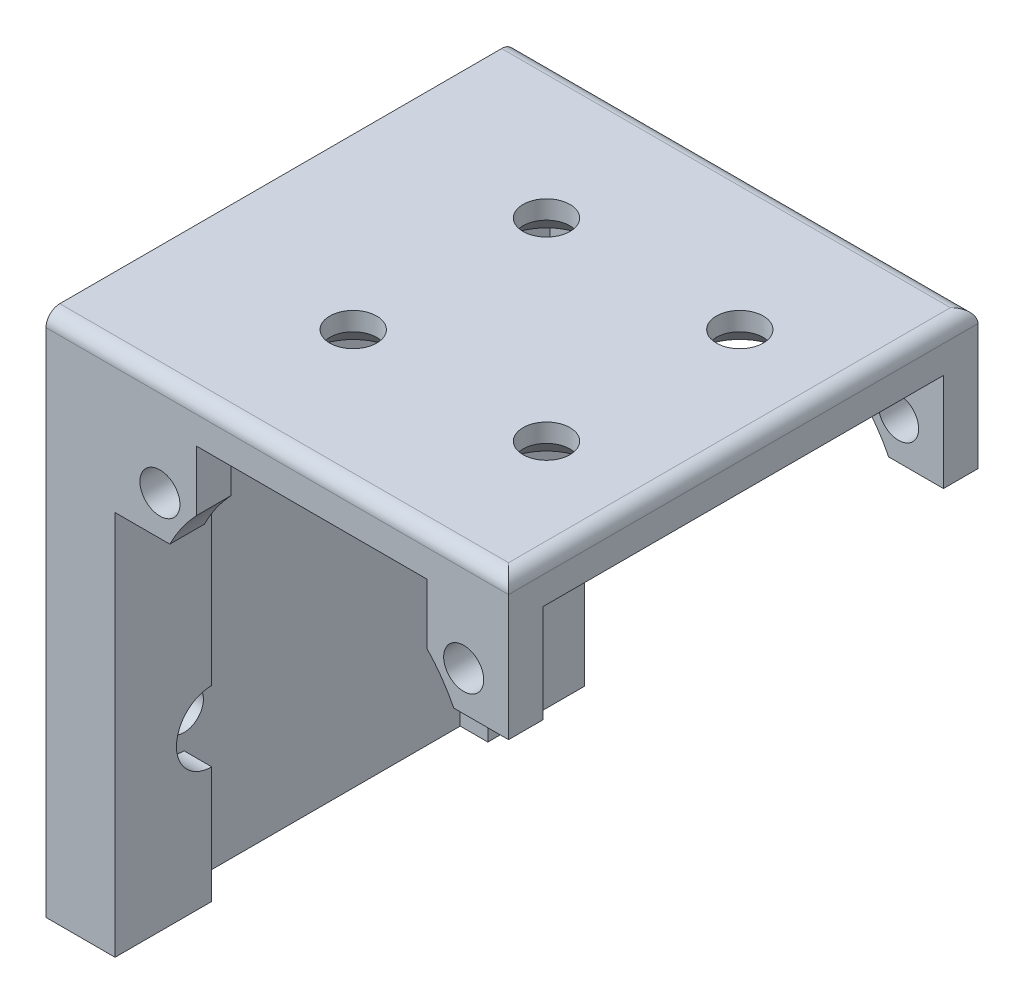
from build123d import *

# Parameters (mm, degrees)
BOSS_EXTRUDE7_DEPTH                            = 17
BOSS_EXTRUDE7_DEPTH_BACK                       = 17
SKETCH1_R                                      = 1.45
SKETCH34_W                                     = 28.4
SKETCH34_H                                     = 7.5
CUT_EXTRUDE11_DEPTH                            = 37.521397837
SKETCH35_R                                     = 5
CUT_EXTRUDE12_DEPTH                            = 25.542055741
CSK_FOR_M3_HEX_SOCKET_COUNTERSUNK_CA_2_COUNT   = 2
CSK_FOR_M3_HEX_SOCKET_COUNTERSUNK_CA_2_PITCH   = 16.5
CSK_FOR_M3_HEX_SOCKET_COUNTERSUNK_CA_3_COUNT   = 2
CSK_FOR_M3_HEX_SOCKET_COUNTERSUNK_CA_3_PITCH   = 18
CSK_FOR_M3_HEX_SOCKET_COUNTERSUNK_CA_4_COUNT   = 2
CSK_FOR_M3_HEX_SOCKET_COUNTERSUNK_CA_4_PITCH   = 24.418230894
FILLET5_R                                      = 1
SKETCH41_W                                     = 28.5
SKETCH41_H                                     = 0.4
CUT_EXTRUDE13_DEPTH                            = 40.895175147
BOSS_EXTRUDE8_START                            = 5
BOSS_EXTRUDE8_DEPTH                            = 5
SKETCH48_R                                     = 1.4
CUT_EXTRUDE14_DEPTH                            = 5
SKETCH49_R                                     = 2.55
CUT_EXTRUDE15_DEPTH                            = 2
SKETCH51_W                                     = 24.851878452
SKETCH51_H                                     = 29.94943361
BOSS_EXTRUDE9_DEPTH                            = 3
CSK_FOR_M3_HEX_SOCKET_COUNTERSUNK_CA_5_A_COUNT = 2
CSK_FOR_M3_HEX_SOCKET_COUNTERSUNK_CA_5_A_PITCH = 14
CSK_FOR_M3_HEX_SOCKET_COUNTERSUNK_CA_6_COUNT   = 2
CSK_FOR_M3_HEX_SOCKET_COUNTERSUNK_CA_6_PITCH   = 19.798989873
CSK_FOR_M3_HEX_SOCKET_COUNTERSUNK_CA_7_COUNT   = 2
CSK_FOR_M3_HEX_SOCKET_COUNTERSUNK_CA_7_PITCH   = 14
SKETCH54_W                                     = 20
SKETCH54_H                                     = 27
CUT_EXTRUDE20_DEPTH                            = 2
SKETCH55_W                                     = 29
SKETCH55_H                                     = 7.1
CUT_EXTRUDE21_DEPTH                            = 28.5
SKETCH56_W                                     = 16.7
SKETCH56_H                                     = 5.607195889
CUT_EXTRUDE22_DEPTH                            = 34


with BuildPart() as part:
    # Sketch1 → Boss-Extrude7 (new, two sides: drawn at the far end of the back side and taken through both)
    with BuildSketch(Plane.XY.offset(-BOSS_EXTRUDE7_DEPTH_BACK)):
        with BuildLine():
            Line((-14.25, 15.25), (-14.25, 4.75))
            Line((-14.25, 4.75), (-10.473180033, 4.75))
            ThreePointArc((-10.473180033, 4.75), (-9.502581542, 6.476954843), (-8.25, 8.011710179))
            Line((-8.25, 8.011710179), (-8.25, 12.25))
            Line((-8.25, 12.25), (8.25, 12.25))
            Line((8.25, 12.25), (8.25, 8.011710179))
            ThreePointArc((8.25, 8.011710179), (9.502581542, 6.476954843), (10.473180033, 4.75))
            Line((10.473180033, 4.75), (14.25, 4.75))
            Line((14.25, 4.75), (14.25, 15.25))
            Line((14.25, 15.25), (-14.25, 15.25))
        make_face()
        with Locations((11, 8)):
            Circle(SKETCH1_R, mode=Mode.SUBTRACT)
        with Locations((-11, 8)):
            Circle(SKETCH1_R, mode=Mode.SUBTRACT)
    extrude(amount=BOSS_EXTRUDE7_DEPTH + BOSS_EXTRUDE7_DEPTH_BACK)

    # Sketch34 → Cut-Extrude11 (cut, through all)
    with BuildSketch(Plane.ZY.offset(14.25)):
        with Locations((0, 8.5)):
            Rectangle(SKETCH34_W, SKETCH34_H)
    extrude(amount=-CUT_EXTRUDE11_DEPTH, mode=Mode.SUBTRACT)

    # Sketch35 → Cut-Extrude12 (cut, through all)
    with BuildSketch(Plane(origin=(0, 15.25, 0), x_dir=(1, 0, 0), z_dir=(0, 1, 0))):
        Circle(SKETCH35_R)
    extrude(amount=-CUT_EXTRUDE12_DEPTH, mode=Mode.SUBTRACT)

    # Sketch40 → CSK for M3 Hex Socket Countersunk Cap Sc (revolve, cut)
    with BuildSketch(Plane(origin=(-8.25, 12.25, 9), x_dir=(0, 0, -1), z_dir=(1, 0, 0))):
        Polygon((0, 0), (0, 3), (1.7, 3), (1.7, 1.66), (3.36, 0), align=None)
    csk_for_m3_hex_socket_countersunk_cap_sc = revolve(axis=Axis((-8.25, 5.9, 9), (0, 1, 0)), mode=Mode.SUBTRACT)

    # CSK for M3 Hex Socket Countersunk Ca 2: CSK for M3 Hex Socket Countersunk Cap Sc ×2
    with Locations(*[(i * CSK_FOR_M3_HEX_SOCKET_COUNTERSUNK_CA_2_PITCH, 0, 0) for i in range(1, CSK_FOR_M3_HEX_SOCKET_COUNTERSUNK_CA_2_COUNT)]):
        add(csk_for_m3_hex_socket_countersunk_cap_sc, mode=Mode.SUBTRACT)

    # CSK for M3 Hex Socket Countersunk Ca 3: CSK for M3 Hex Socket Countersunk Cap Sc ×2
    with Locations(*[(0, 0, -i * CSK_FOR_M3_HEX_SOCKET_COUNTERSUNK_CA_3_PITCH) for i in range(1, CSK_FOR_M3_HEX_SOCKET_COUNTERSUNK_CA_3_COUNT)]):
        add(csk_for_m3_hex_socket_countersunk_cap_sc, mode=Mode.SUBTRACT)

    # CSK for M3 Hex Socket Countersunk Ca 4: CSK for M3 Hex Socket Countersunk Cap Sc ×2
    with Locations(*[Vector(0.6757246285173466, 0, -0.7371541402007413) * (i * CSK_FOR_M3_HEX_SOCKET_COUNTERSUNK_CA_4_PITCH) for i in range(1, CSK_FOR_M3_HEX_SOCKET_COUNTERSUNK_CA_4_COUNT)]):
        add(csk_for_m3_hex_socket_countersunk_cap_sc, mode=Mode.SUBTRACT)

    # Fillet5
    fillet5_edges = [part.edges().sort_by_distance(p)[0] for p in [
        (14.25, 15.25, 0),
        (0, 15.25, -17),
        (0, 15.25, 17),
    ]]
    fillet(fillet5_edges, radius=FILLET5_R)

    # Sketch41 → Cut-Extrude13 (cut, through all)
    with BuildSketch(Plane.XY.offset(17)):
        with Locations((0, 4.95)):
            Rectangle(SKETCH41_W, SKETCH41_H)
    extrude(amount=-CUT_EXTRUDE13_DEPTH, mode=Mode.SUBTRACT)

    # Sketch46 → Boss-Extrude8 (add)
    with BuildSketch(Plane.ZY.offset(14.25).offset(BOSS_EXTRUDE8_START)):
        with BuildLine():
            ThreePointArc((17, 14.25), (16.707106781, 14.957106781), (16, 15.25))
            Line((16, 15.25), (-16, 15.25))
            ThreePointArc((-16, 15.25), (-16.707106781, 14.957106781), (-17, 14.25))
            Line((-17, 14.25), (-17, -22.75))
            Line((-17, -22.75), (17, -22.75))
            Line((17, -22.75), (17, 14.25))
        make_face()
    extrude(amount=-BOSS_EXTRUDE8_DEPTH)

    # Sketch48 → Cut-Extrude14 (cut)
    with BuildSketch(Plane.ZY.offset(19.25)):
        with Locations((-10, -11.75)):
            Circle(SKETCH48_R)
        with Locations((10, -11.75)):
            Circle(SKETCH48_R)
        with Locations((10, 4.25)):
            Circle(SKETCH48_R)
        with Locations((-10, 4.25)):
            Circle(SKETCH48_R)
    extrude(amount=-CUT_EXTRUDE14_DEPTH, mode=Mode.SUBTRACT)

    # Sketch49 → Cut-Extrude15 (cut)
    with BuildSketch(Plane(origin=(-14.25, 0, 0), x_dir=(0, 0, -1), z_dir=(1, 0, 0))):
        with Locations((-10, -11.75)):
            Circle(SKETCH49_R)
        with Locations((10, -11.75)):
            Circle(SKETCH49_R)
        with Locations((10, 4.25)):
            Circle(SKETCH49_R)
        with Locations((-10, 4.25)):
            Circle(SKETCH49_R)
    extrude(amount=-CUT_EXTRUDE15_DEPTH, mode=Mode.SUBTRACT)

    # Sketch51 → Boss-Extrude9 (add)
    with BuildSketch(Plane(origin=(0, 15.25, 0), x_dir=(1, 0, 0), z_dir=(0, 1, 0))):
        Rectangle(SKETCH51_W, SKETCH51_H)
    extrude(amount=-BOSS_EXTRUDE9_DEPTH)

    # Sketch53 → CSK for M3 Hex Socket Countersunk Ca 5 (revolve, cut)
    with BuildSketch(Plane(origin=(-7, 12.25, 7), x_dir=(0, 0, -1), z_dir=(1, 0, 0))):
        Polygon((0, 0), (0, 3), (1.7, 3), (1.7, 1.66), (3.36, 0), align=None)
    csk_for_m3_hex_socket_countersunk_ca_5 = revolve(axis=Axis((-7, 5.9, 7), (0, 1, 0)), mode=Mode.SUBTRACT)

    # CSK for M3 Hex Socket Countersunk Ca 5 a: CSK for M3 Hex Socket Countersunk Ca 5 ×2
    with Locations(*[(0, 0, -i * CSK_FOR_M3_HEX_SOCKET_COUNTERSUNK_CA_5_A_PITCH) for i in range(1, CSK_FOR_M3_HEX_SOCKET_COUNTERSUNK_CA_5_A_COUNT)]):
        add(csk_for_m3_hex_socket_countersunk_ca_5, mode=Mode.SUBTRACT)

    # CSK for M3 Hex Socket Countersunk Ca 6: CSK for M3 Hex Socket Countersunk Ca 5 ×2
    with Locations(*[Vector(0.7071067811865512, 0, -0.7071067811865438) * (i * CSK_FOR_M3_HEX_SOCKET_COUNTERSUNK_CA_6_PITCH) for i in range(1, CSK_FOR_M3_HEX_SOCKET_COUNTERSUNK_CA_6_COUNT)]):
        add(csk_for_m3_hex_socket_countersunk_ca_5, mode=Mode.SUBTRACT)

    # CSK for M3 Hex Socket Countersunk Ca 7: CSK for M3 Hex Socket Countersunk Ca 5 ×2
    with Locations(*[(i * CSK_FOR_M3_HEX_SOCKET_COUNTERSUNK_CA_7_PITCH, 0, 0) for i in range(1, CSK_FOR_M3_HEX_SOCKET_COUNTERSUNK_CA_7_COUNT)]):
        add(csk_for_m3_hex_socket_countersunk_ca_5, mode=Mode.SUBTRACT)

    # Sketch54 → Cut-Extrude20 (cut)
    with BuildSketch(Plane(origin=(-14.25, 0, 0), x_dir=(0, 0, -1), z_dir=(1, 0, 0))):
        with Locations((0, -9.25)):
            Rectangle(SKETCH54_W, SKETCH54_H)
    extrude(amount=-CUT_EXTRUDE20_DEPTH, mode=Mode.SUBTRACT)

    # Sketch55 → Cut-Extrude21 (cut)
    with BuildSketch(Plane(origin=(14.25, 0, 0), x_dir=(0, 0, -1), z_dir=(1, 0, 0))):
        with Locations((0, 8.7)):
            Rectangle(SKETCH55_W, SKETCH55_H)
    extrude(amount=-CUT_EXTRUDE21_DEPTH, mode=Mode.SUBTRACT)

    # Sketch56 → Cut-Extrude22 (cut)
    with BuildSketch(Plane.XY.offset(17)):
        with Locations((0, 9.462449483)):
            Rectangle(SKETCH56_W, SKETCH56_H)
    extrude(amount=-CUT_EXTRUDE22_DEPTH, mode=Mode.SUBTRACT)


solid = part.part
